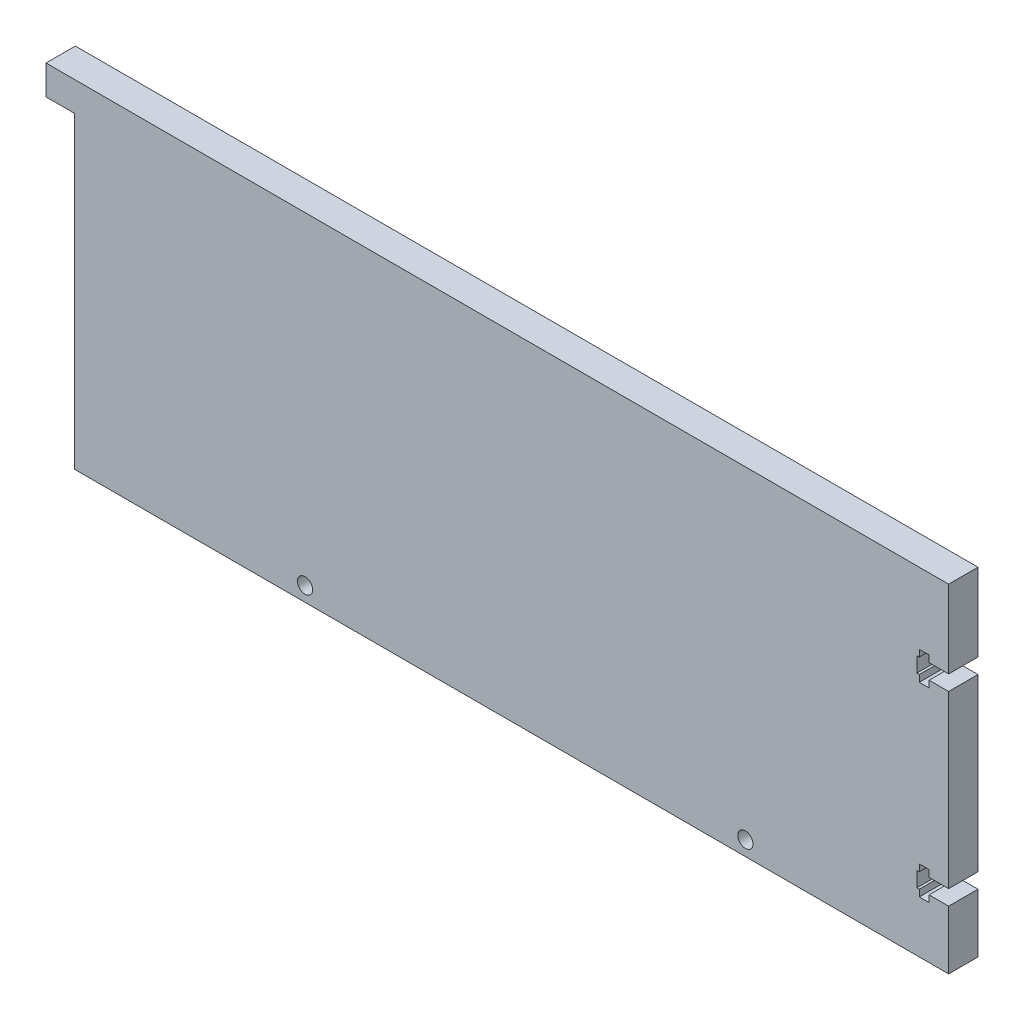
from build123d import *

# Parameters (mm, degrees)
SZKIC1_W                    = 178.7
SZKIC1_H                    = 69
DODANIE_WYCI_GNI_CIE1_DEPTH = 6
SZKIC3_R                    = 1.55
WYTNIJ_WYCI_GNI_CIE1_DEPTH  = 204.563124249
WYTNIJ_WYCI_GNI_CIE2_DEPTH  = 204.563124249
SZYK_LINIOWY1_COUNT         = 2
SZYK_LINIOWY1_PITCH         = 38
SZKIC5_W                    = 6
SZKIC5_H                    = 6
DODANIE_WYCI_GNI_CIE2_DEPTH = 5.8


with BuildPart() as part:
    # Szkic1 → Dodanie-wyciągnięcie1 (new body)
    with BuildSketch(Plane.XY):
        with Locations((83.35, 73.094867693)):
            Rectangle(SZKIC1_W, SZKIC1_H)
    extrude(amount=-DODANIE_WYCI_GNI_CIE1_DEPTH)

    # Szkic3 → Wytnij-wyciągnięcie1 (cut, through all)
    with BuildSketch(Plane(origin=(0, 0, -6), x_dir=(-1, 0, 0), z_dir=(0, 0, -1))):
        with Locations((-41.15, 41.594867693)):
            Circle(SZKIC3_R)
        with Locations((-131.15, 41.594867693)):
            Circle(SZKIC3_R)
    extrude(amount=-WYTNIJ_WYCI_GNI_CIE1_DEPTH, mode=Mode.SUBTRACT)

    # Szkic4 → Wytnij-wyciągnięcie2 (cut, through all)
    with BuildSketch(Plane(origin=(0, 0, -6), x_dir=(-1, 0, 0), z_dir=(0, 0, -1))):
        Polygon((-172.7, 50.594867693), (-172.7, 53.694867693), (-168.7, 53.694867693), (-168.7, 55.069867693), (-166.7, 55.069867693), (-166.7, 53.694867693), (-166.2, 53.694867693), (-166.2, 50.594867693), (-166.7, 50.594867693), (-166.7, 49.219867693), (-168.7, 49.219867693), (-168.7, 50.594867693), align=None)
    wytnij_wyci_gni_cie2 = extrude(amount=-WYTNIJ_WYCI_GNI_CIE2_DEPTH, mode=Mode.SUBTRACT)

    # Szyk liniowy1: Wytnij-wyciągnięcie2 ×2
    with Locations(*[(0, i * SZYK_LINIOWY1_PITCH, 0) for i in range(1, SZYK_LINIOWY1_COUNT)]):
        add(wytnij_wyci_gni_cie2, mode=Mode.SUBTRACT)

    # Szkic5 → Dodanie-wyciągnięcie2 (add)
    with BuildSketch(Plane.ZY.offset(6)):
        with Locations((-3, 104.594867693)):
            Rectangle(SZKIC5_W, SZKIC5_H)
    extrude(amount=DODANIE_WYCI_GNI_CIE2_DEPTH)


solid = part.part
